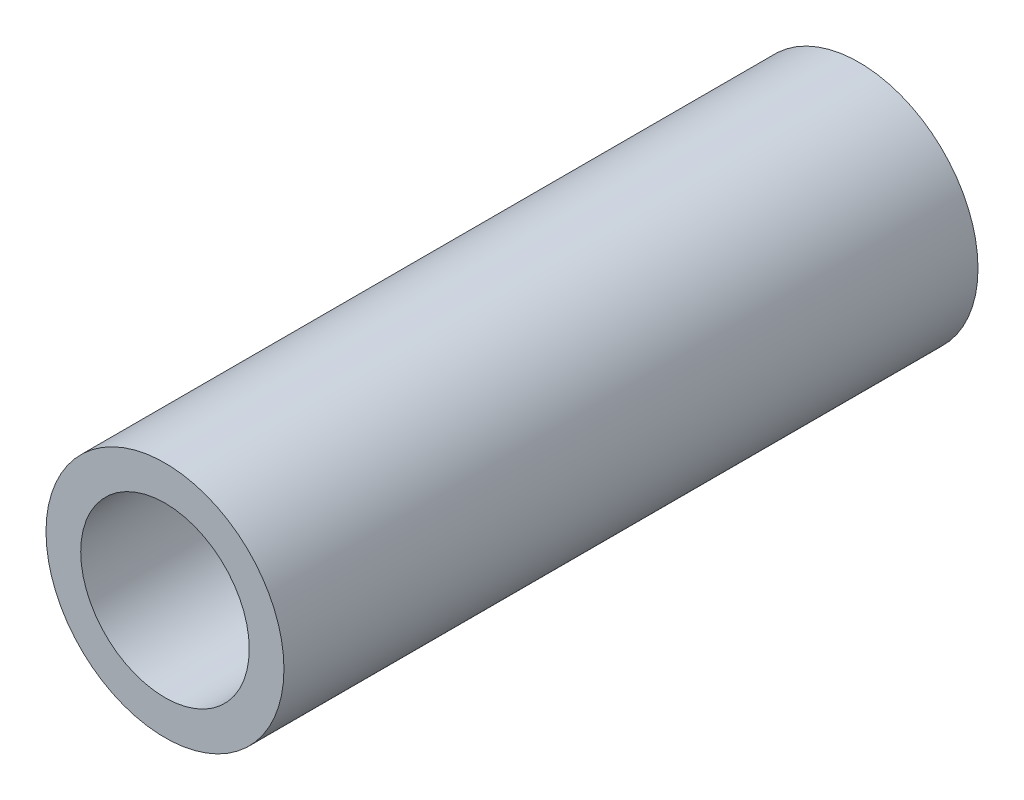
from build123d import *

# Parameters (mm, degrees)
SKIZZE1_W = 35
SKIZZE1_H = 1.75


with BuildPart() as part:
    # Skizze1 → Rotation1 (revolve)
    with BuildSketch(Plane(origin=(0, 0, 0), x_dir=(0, 0, -1), z_dir=(1, 0, 0)), mode=Mode.PRIVATE) as rotation1_sk:
        with Locations((0, 5.125)):
            Rectangle(SKIZZE1_W, SKIZZE1_H)
    revolve(rotation1_sk.sketch.rotate(Axis((0, 0, 75.678327167), (0, 0, -1)), 90), axis=Axis((0, 0, 75.678327167), (0, 0, -1)))


solid = part.part
